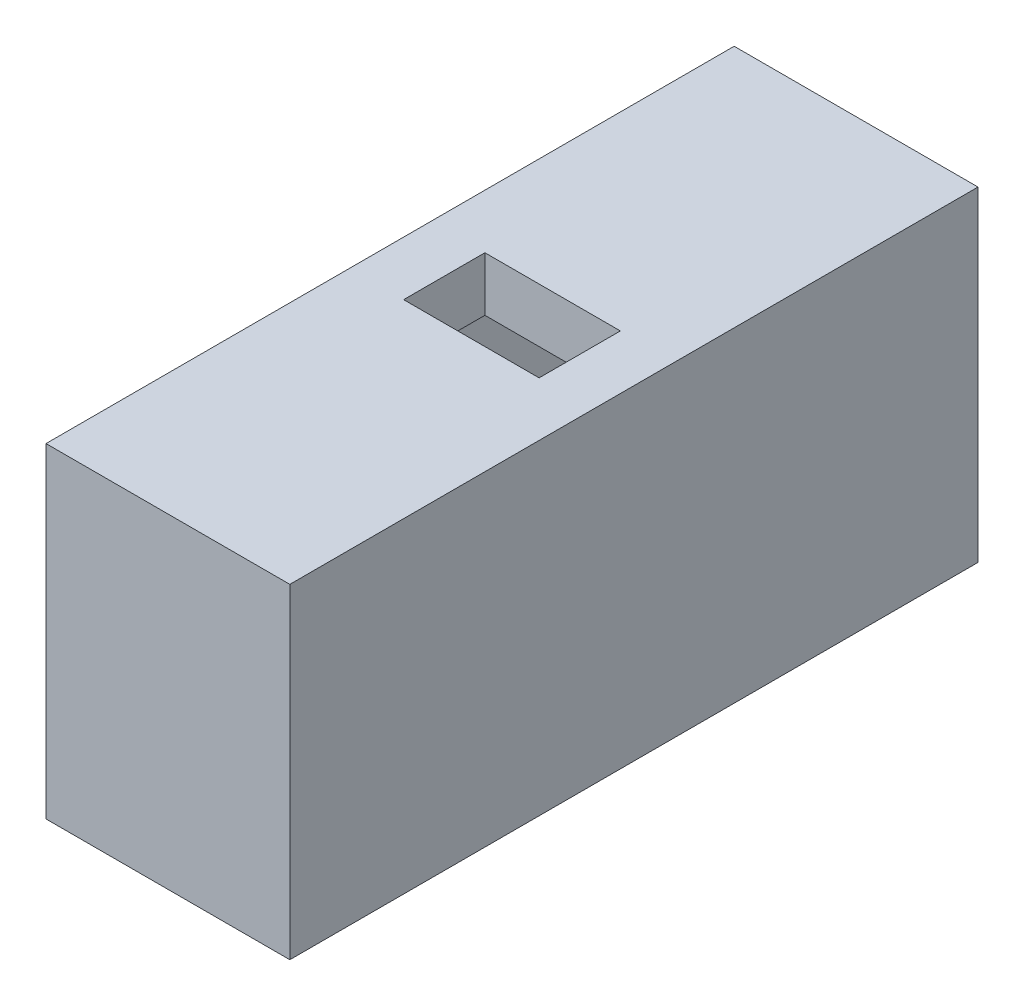
from build123d import *

# Parameters (mm, degrees)
SKETCH1_W           = 9
SKETCH1_H           = 25.4
BOSS_EXTRUDE1_DEPTH = 12
SKETCH2_W           = 5
SKETCH2_H           = 3
CUT_EXTRUDE1_DEPTH  = 30.498474537
SKETCH4_W           = 5.5
SKETCH4_H           = 8
CUT_EXTRUDE2_DEPTH  = 22
SKETCH7_W           = 5.5
SKETCH7_H           = 8
SKETCH7_R           = 2.235
BOSS_EXTRUDE3_DEPTH = 7.8
SKETCH8_R           = 2.235
BOSS_EXTRUDE4_DEPTH = 3.4162


with BuildPart() as part:
    # Sketch1 → Boss-Extrude1 (new body)
    with BuildSketch(Plane(origin=(0, 0, 0), x_dir=(1, 0, 0), z_dir=(0, 1, 0))):
        with Locations((-4.5, 12.7)):
            Rectangle(SKETCH1_W, SKETCH1_H)
    extrude(amount=BOSS_EXTRUDE1_DEPTH)

    # Sketch2 → Cut-Extrude1 (cut, through all)
    with BuildSketch(Plane(origin=(0, 12, 0), x_dir=(1, 0, 0), z_dir=(0, 1, 0))):
        with Locations((-4.5, 12.7)):
            Rectangle(SKETCH2_W, SKETCH2_H)
    extrude(amount=-CUT_EXTRUDE1_DEPTH, mode=Mode.SUBTRACT)

    # Sketch4 → Cut-Extrude2 (cut)
    with BuildSketch(Plane(origin=(0, 0, -25.4), x_dir=(-1, 0, 0), z_dir=(0, 0, -1))):
        with Locations((4.5, 6)):
            Rectangle(SKETCH4_W, SKETCH4_H)
    extrude(amount=-CUT_EXTRUDE2_DEPTH, mode=Mode.SUBTRACT)

    # Sketch7 → Boss-Extrude3 (add)
    with BuildSketch(Plane(origin=(0, 0, -3.4), x_dir=(-1, 0, 0), z_dir=(0, 0, -1))):
        with Locations((4.5, 6)):
            Rectangle(SKETCH7_W, SKETCH7_H)
        with Locations(Location((4.5, 6, 0), (0, 0, 180))):
            Circle(SKETCH7_R, mode=Mode.SUBTRACT)
    extrude(amount=BOSS_EXTRUDE3_DEPTH)

    # Sketch8 → Boss-Extrude4 (add)
    with BuildSketch(Plane(origin=(0, 0, -3.4), x_dir=(-1, 0, 0), z_dir=(0, 0, -1))):
        with Locations(Location((4.5, 6, 0), (0, 0, 180))):
            Circle(SKETCH8_R)
    extrude(amount=BOSS_EXTRUDE4_DEPTH)


solid = part.part
